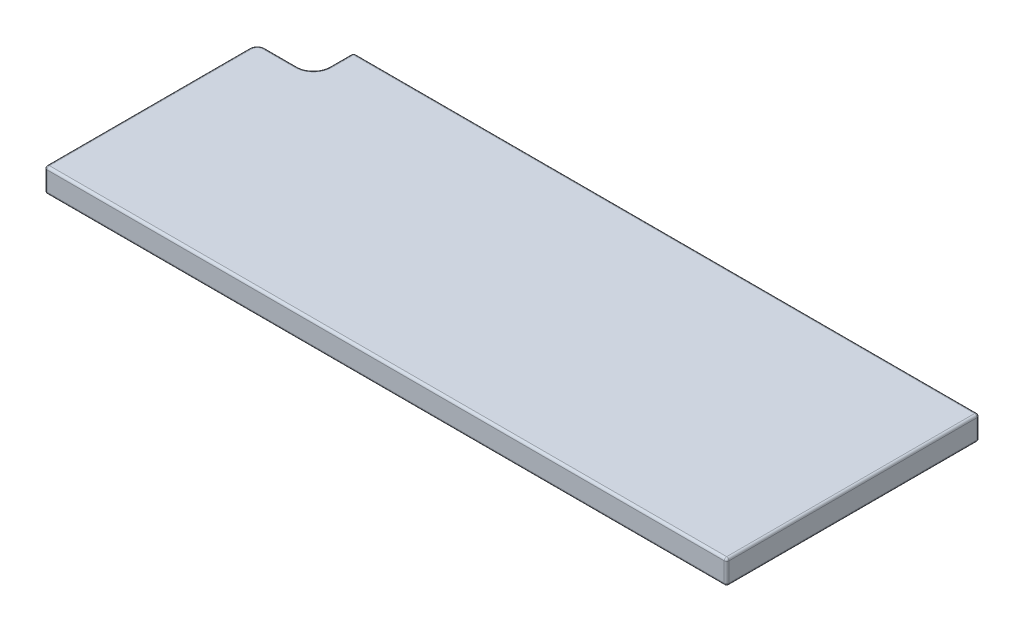
from build123d import *

# Parameters (mm, degrees)
EXTRUDE_1_DEPTH = 30
FILLET_2_R      = 3


with BuildPart() as part:
    # 草图1 → 凸台-拉伸1 (new body)
    with BuildSketch(Plane(origin=(0, 0, 0), x_dir=(1, 0, 0), z_dir=(0, 1, 0))):
        with BuildLine():
            Line((-425, 140), (-425, -115))
            Line((-425, -115), (425, -115))
            Line((425, -115), (425, 200))
            Line((425, 200), (-355, 200))
            Line((-355, 200), (-355, 170))
            ThreePointArc((-355, 170), (-360.857864376, 155.857864376), (-375, 150))
            Line((-375, 150), (-415, 150))
            ThreePointArc((-415, 150), (-422.071067812, 147.071067812), (-425, 140))
        make_face()
    extrude(amount=EXTRUDE_1_DEPTH)

    # 圆角2
    fillet_2_edges = [part.edges().sort_by_distance(p)[0] for p in [
        (-360.857864376, 0, -155.857864376),
        (-355, 0, -185),
        (35, 0, -200),
        (425, 0, -42.5),
        (-355, 30, -185),
        (425, 15, 115),
        (-425, 15, 115),
        (-355, 15, -200),
        (425, 15, -200),
        (-360.857864376, 30, -155.857864376),
        (-395, 30, -150),
        (-422.071067812, 30, -147.071067812),
        (-425, 30, -12.5),
        (0, 30, 115),
        (425, 30, -42.5),
        (0, 0, 115),
        (35, 30, -200),
        (-425, 0, -12.5),
        (-422.071067812, 0, -147.071067812),
        (-395, 0, -150),
    ]]
    fillet(fillet_2_edges, radius=FILLET_2_R)


solid = part.part
